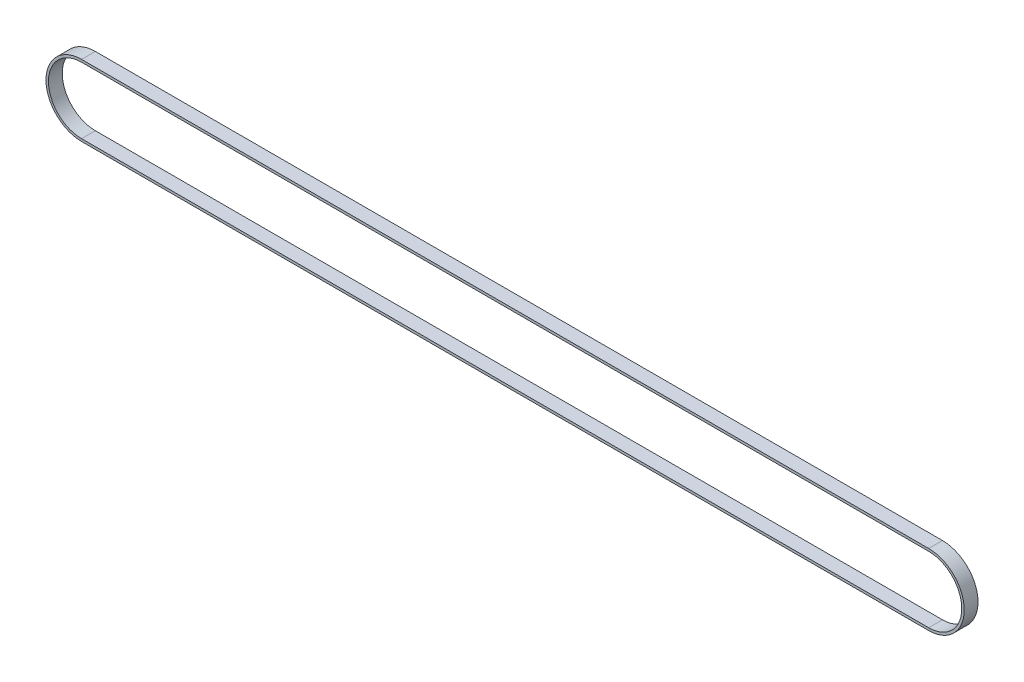
from build123d import *

# Parameters (mm, degrees)
EXTRUDE_1_DEPTH = 12.7


with BuildPart() as part:
    # 草图1 → 凸台-拉伸1 (new body)
    with BuildSketch(Plane.XY):
        with BuildLine():
            Line((0, 32.74), (780, 32.74))
            ThreePointArc((780, 32.74), (812.74, 0), (780, -32.74))
            Line((780, -32.74), (0, -32.74))
            ThreePointArc((0, -32.74), (-32.74, 0), (0, 32.74))
        make_face()
        with BuildLine():
            Line((0, 30.47), (780, 30.47))
            ThreePointArc((780, 30.47), (810.47, 0), (780, -30.47))
            Line((780, -30.47), (0, -30.47))
            ThreePointArc((0, -30.47), (-30.47, 0), (0, 30.47))
        make_face(mode=Mode.SUBTRACT)
    extrude(amount=EXTRUDE_1_DEPTH)


solid = part.part
